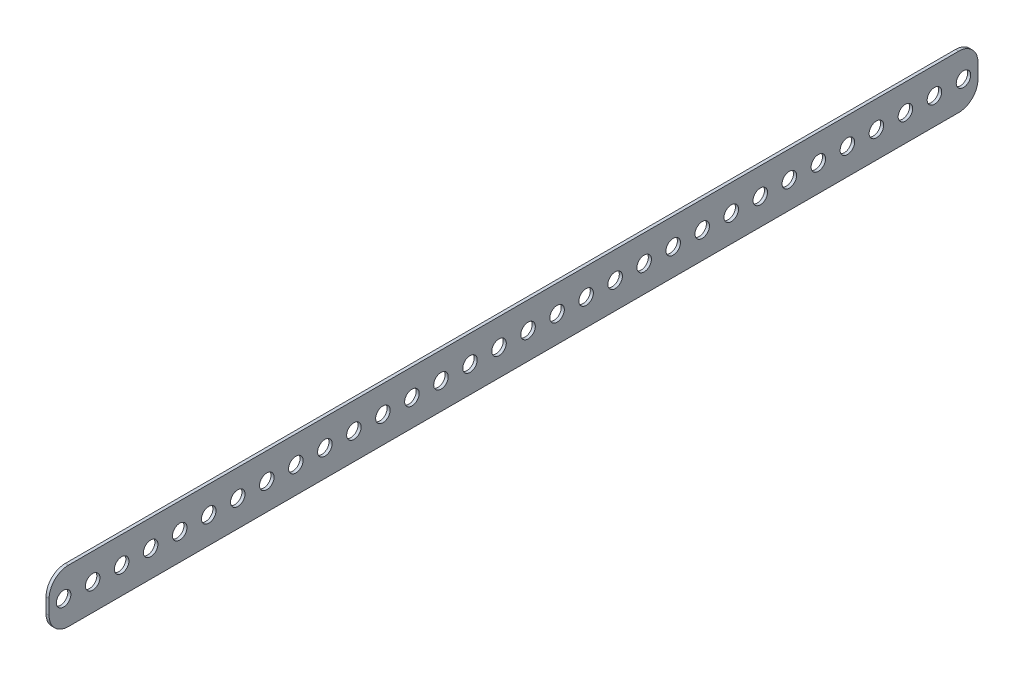
from build123d import *

# Parameters (mm, degrees)
SKETCH1_W           = 2.032
SKETCH1_H           = 34.925
BOSS_EXTRUDE1_DEPTH = 304.8
CUT_EXTRUDE1_REACH  = 308.801
SKETCH2_R           = 4.7625
LPATTERN1_COUNT     = 32
LPATTERN1_PITCH     = 19.05
FILLET1_R           = 12.7


with BuildPart() as part:
    # Sketch1 → Boss-Extrude1 (new, symmetric)
    with BuildSketch(Plane.XY):
        with Locations((1.016, 17.4625)):
            Rectangle(SKETCH1_W, SKETCH1_H)
    extrude(amount=BOSS_EXTRUDE1_DEPTH, both=True)

    # Sketch2 → Cut-Extrude1 (cut, up to next)
    with BuildSketch(Plane.ZY, mode=Mode.PRIVATE) as cut_extrude1_sk1:
        with Locations((295.275, 17.4625)):
            Circle(SKETCH2_R)
    cut_extrude1_tool1 = extrude(cut_extrude1_sk1.sketch, amount=-CUT_EXTRUDE1_REACH, mode=Mode.PRIVATE) & part.part
    cut_extrude1 = cut_extrude1_tool1.solids().sort_by_distance((0, 17.4625, 295.275))[0]
    add(cut_extrude1, mode=Mode.SUBTRACT)

    # LPattern1: Cut-Extrude1 ×32
    with Locations(*[(0, 0, -i * LPATTERN1_PITCH) for i in range(1, LPATTERN1_COUNT)]):
        add(cut_extrude1, mode=Mode.SUBTRACT)

    # Fillet1
    fillet1_edges = [part.edges().sort_by_distance(p)[0] for p in [
        (1.016, 34.925, 304.8),
        (1.016, 34.925, -304.8),
        (1.016, 0, -304.8),
        (1.016, 0, 304.8),
    ]]
    fillet(fillet1_edges, radius=FILLET1_R)


solid = part.part
